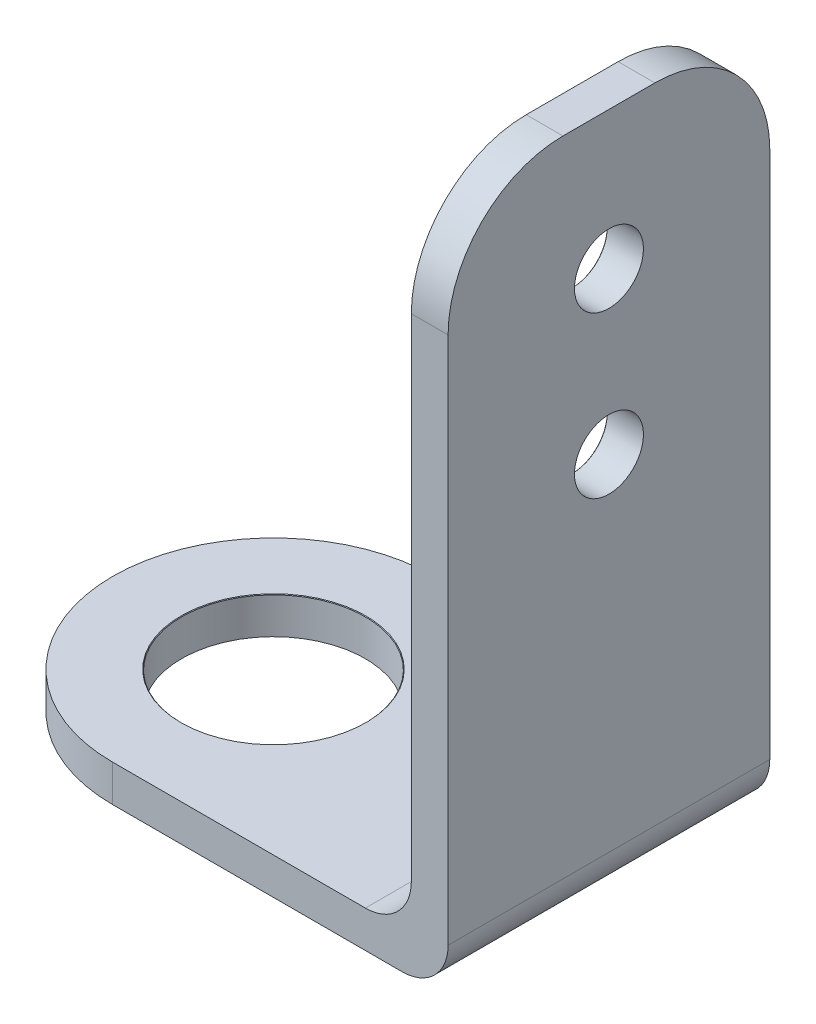
from build123d import *

# Parameters (mm, degrees)
BOSS_EXTRUDE1_DEPTH             = 14
FILLET1_RADIUS                  = 7
FILLET1_LENGTH                  = 1.6
F_8_0MM_DOWEL_HOLE2_D           = 8
F_8_0MM_DOWEL_HOLE2_DEPTH       = 30
F_8_0MM_DOWEL_HOLE2_CSINK_D     = 8.05
F_8_0MM_DOWEL_HOLE2_CSINK_ANGLE = 90
F_8_0MM_DOWEL_HOLE2_TIP         = 2.403442476
F_3_0MM_DOWEL_HOLE1_D           = 3
F_3_0MM_DOWEL_HOLE1_DEPTH       = 30
F_3_0MM_DOWEL_HOLE1_CSINK_D     = 3.05
F_3_0MM_DOWEL_HOLE1_CSINK_ANGLE = 90
F_3_0MM_DOWEL_HOLE1_TIP         = 0.901290929
FILLET2_R                       = 5
FILLET3_R                       = 2


with BuildPart() as part:
    # Sketch1 → Boss-Extrude1 (new body)
    with BuildSketch(Plane.XY):
        Polygon((0, 0), (21.6, 0), (21.6, 30), (20, 30), (20, 1.6), (0, 1.6), align=None)
    extrude(amount=BOSS_EXTRUDE1_DEPTH)

    # Fillet1: full round fillet: the end face becomes a half cylinder, R = half its width
    fillet1_face = Plane((0, 0.8, 7), x_dir=(0, 1, 0), z_dir=(-1, 0, 0))  # on the end face: x along it, z out of the body
    fillet1_slab = fillet1_face.offset(-FILLET1_RADIUS / 2) * Box(FILLET1_LENGTH, 2 * FILLET1_RADIUS, FILLET1_RADIUS, mode=Mode.PRIVATE)  # the body's end, R deep
    fillet1_round = Plane((7, 0.8, 7), x_dir=(-1, 0, 0), z_dir=(0, 1, 0)) * Cylinder(FILLET1_RADIUS, FILLET1_LENGTH, mode=Mode.PRIVATE)  # its axis R under the face
    add(fillet1_slab - fillet1_round, mode=Mode.SUBTRACT)

    # Ø8.0mm Dowel Hole2
    with Locations(Plane(origin=(0, 1.6, 0), x_dir=(1, 0, 0), z_dir=(0, 1, 0))):
        with Locations((7, -7)):
            CounterSinkHole(F_8_0MM_DOWEL_HOLE2_D / 2, F_8_0MM_DOWEL_HOLE2_CSINK_D / 2, depth=F_8_0MM_DOWEL_HOLE2_DEPTH, counter_sink_angle=F_8_0MM_DOWEL_HOLE2_CSINK_ANGLE)
            with Locations((0, 0, -(F_8_0MM_DOWEL_HOLE2_DEPTH + F_8_0MM_DOWEL_HOLE2_TIP / 2))):  # 118° drill point
                Cone(0, F_8_0MM_DOWEL_HOLE2_D / 2, F_8_0MM_DOWEL_HOLE2_TIP, mode=Mode.SUBTRACT)

    # Ø3.0mm Dowel Hole1
    with Locations(Plane.ZY.offset(-20)):
        with Locations((7, 24), (7, 17)):
            CounterSinkHole(F_3_0MM_DOWEL_HOLE1_D / 2, F_3_0MM_DOWEL_HOLE1_CSINK_D / 2, depth=F_3_0MM_DOWEL_HOLE1_DEPTH, counter_sink_angle=F_3_0MM_DOWEL_HOLE1_CSINK_ANGLE)
            with Locations((0, 0, -(F_3_0MM_DOWEL_HOLE1_DEPTH + F_3_0MM_DOWEL_HOLE1_TIP / 2))):  # 118° drill point
                Cone(0, F_3_0MM_DOWEL_HOLE1_D / 2, F_3_0MM_DOWEL_HOLE1_TIP, mode=Mode.SUBTRACT)

    # Fillet2
    fillet2_edges = [part.edges().sort_by_distance(p)[0] for p in [
        (20.8, 30, 14),
        (20.8, 30, 0),
    ]]
    fillet(fillet2_edges, radius=FILLET2_R)

    # Fillet3
    fillet3_edges = [part.edges().sort_by_distance(p)[0] for p in [
        (20, 1.6, 7),
        (21.6, 0, 7),
    ]]
    fillet(fillet3_edges, radius=FILLET3_R)


solid = part.part
